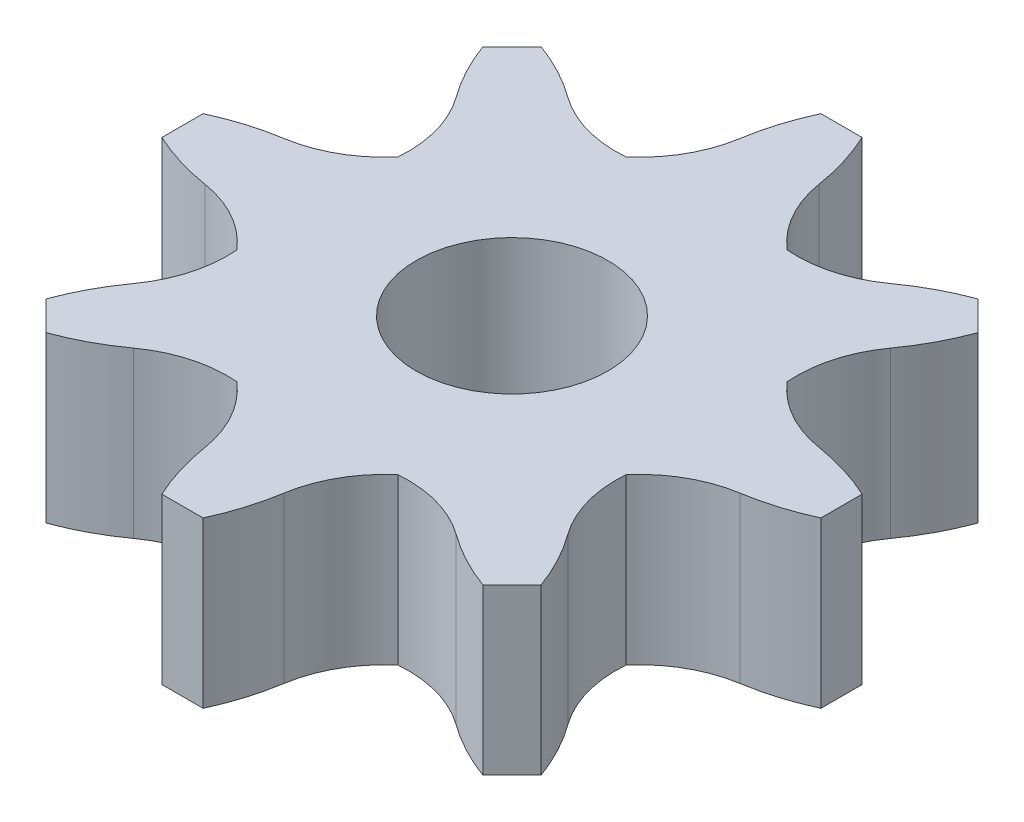
from build123d import *

# Parameters (mm, degrees)
BOSS_EXTRUDE1_DEPTH = 4
CIRPATTERN2_COUNT   = 8
BOSS_EXTRUDE3_DEPTH = 4


with BuildPart() as part:
    # Sketch1 → Boss-Extrude1 (new body)
    with BuildSketch(Plane(origin=(0, 0, 0), x_dir=(1, 0, 0), z_dir=(0, 1, 0))):
        with BuildLine():
            Line((0.5, 7.99381848), (-0.5, 7.99381848))
            ThreePointArc((-0.5, 7.99381848), (-0.952778657, 6.527614923), (-1, 4.99381848))
            Line((-1, 4.99381848), (1, 4.99381848))
            ThreePointArc((1, 4.99381848), (0.952778657, 6.527614923), (0.5, 7.99381848))
        make_face()
        with BuildLine():
            Line((0, 6.49381848), (0.9583076, 6.49381848))
            ThreePointArc((0.9583076, 6.49381848), (1.313042081, 5.493220974), (2, 4.683825681))
            Line((2, 4.683825681), (-2, 4.683825681))
            ThreePointArc((-2, 4.683825681), (-1.313042081, 5.493220974), (-0.9583076, 6.49381848))
            Line((-0.9583076, 6.49381848), (0, 6.49381848))
        make_face()
    boss_extrude1 = extrude(amount=BOSS_EXTRUDE1_DEPTH)

    # CirPattern2: Boss-Extrude1 ×8 about axis
    cirpattern2_axis = Axis((0, 0, 0), (0, 1, 0))
    for i in range(1, CIRPATTERN2_COUNT):
        add(boss_extrude1.rotate(cirpattern2_axis, i * 360 / CIRPATTERN2_COUNT))

    # Sketch1<5> → Boss-Extrude3 (add)
    with BuildSketch(Plane(origin=(0, 0, 0), x_dir=(1, 0, 0), z_dir=(0, 1, 0))):
        with BuildLine():
            ThreePointArc((5.092958179, 0), (4.249949374, 2.806448526), (2, 4.683825681))
            Line((2, 4.683825681), (-2, 4.683825681))
            ThreePointArc((-2, 4.683825681), (-2.806448526, -4.249949374), (5.092958179, 0))
        make_face()
        with BuildLine():
            ThreePointArc((0.884943501, -2.15), (0.451040464, -2.280830441), (0, -2.325))
            ThreePointArc((0, -2.325), (-0.451040464, -2.280830441), (-0.884943501, -2.15))
            ThreePointArc((-0.884943501, -2.15), (-2.280830441, 0.451040464), (0, 2.325))
            ThreePointArc((0, 2.325), (1.644023266, 1.644023266), (2.325, 0))
            ThreePointArc((2.325, 0), (1.931724442, -1.293856901), (0.884943501, -2.15))
        make_face(mode=Mode.SUBTRACT)
    extrude(amount=BOSS_EXTRUDE3_DEPTH)


solid = part.part
